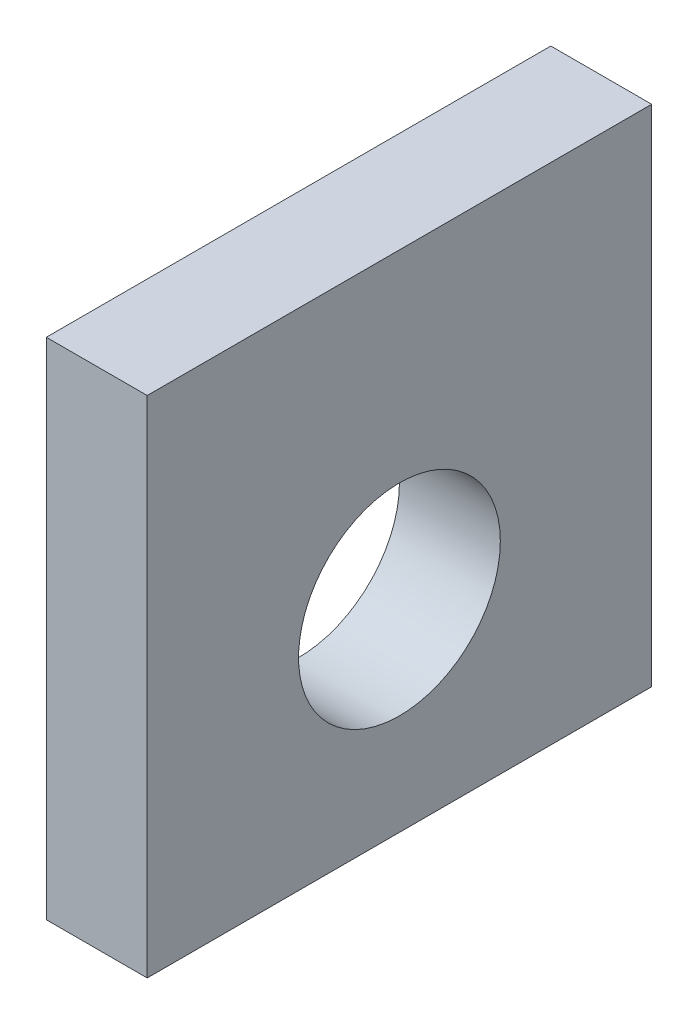
from build123d import *

# Parameters (mm, degrees)
SKETCH1_W           = 15.875
SKETCH1_H           = 15.875
BOSS_EXTRUDE1_DEPTH = 3.175
CUT_EXTRUDE1_REACH  = 13.666
SKETCH2_R           = 3.175


with BuildPart() as part:
    # Sketch1 → Boss-Extrude1 (new body)
    with BuildSketch(Plane(origin=(0, 0, 0), x_dir=(0, 0, -1), z_dir=(1, 0, 0))):
        Rectangle(SKETCH1_W, SKETCH1_H)
    extrude(amount=BOSS_EXTRUDE1_DEPTH)

    # Sketch2 → Cut-Extrude1 (cut, up to next)
    with BuildSketch(Plane(origin=(3.175, 0, 0), x_dir=(0, 0, -1), z_dir=(1, 0, 0)), mode=Mode.PRIVATE) as cut_extrude1_sk1:
        with Locations((0, -1.5875)):
            Circle(SKETCH2_R)
    cut_extrude1_tool1 = extrude(cut_extrude1_sk1.sketch, amount=-CUT_EXTRUDE1_REACH, mode=Mode.PRIVATE) & part.part
    add(cut_extrude1_tool1.solids().sort_by_distance((3.175, -1.5875, 0))[0], mode=Mode.SUBTRACT)


solid = part.part
